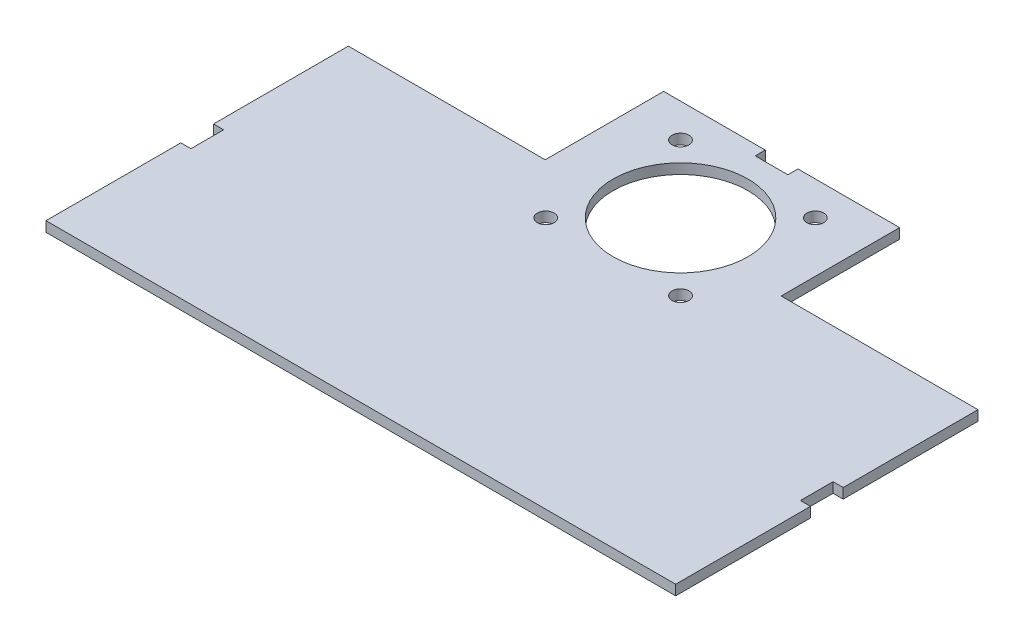
from build123d import *

# Parameters (mm, degrees)
BOSS_EXTRUDE1_DEPTH = 3
SKETCH3_R           = 2.5
SKETCH3_R_2         = 20
CUT_EXTRUDE1_DEPTH  = 10


with BuildPart() as part:
    # Sketch1 → Boss-Extrude1 (new body)
    with BuildSketch(Plane(origin=(0, 0, 0), x_dir=(1, 0, 0), z_dir=(0, 1, 0))):
        Polygon((-148.288384344, -111.309139144), (-148.288384344, -101.609139144), (-151.288384344, -101.609139144), (-151.288384344, -61.609139144), (-92.878384344, -61.609139144), (-92.878384344, -26.459139144), (-62.728384344, -26.459139144), (-62.728384344, -29.459139144), (-53.028384344, -29.459139144), (-53.028384344, -26.459139144), (-22.878384344, -26.459139144), (-22.878384344, -61.609139144), (35.531615656, -61.609139144), (35.531615656, -101.609139144), (32.531615656, -101.609139144), (32.531615656, -111.309139144), (35.531615656, -111.309139144), (35.531615656, -151.309139144), (-151.288384344, -151.309139144), (-151.288384344, -111.309139144), align=None)
    extrude(amount=BOSS_EXTRUDE1_DEPTH)

    # Sketch3 → Cut-Extrude1 (cut)
    with BuildSketch(Plane(origin=(0, 3, 0), x_dir=(1, 0, 0), z_dir=(0, 1, 0))):
        with Locations(Location((-77.878384344, -36.459139144, 0), (0, 0, 270))):
            Circle(SKETCH3_R)
        with Locations(Location((-37.878384344, -36.459139144, 0), (0, 0, 270))):
            Circle(SKETCH3_R)
        with Locations(Location((-37.878384344, -76.459139144, 0), (0, 0, 90))):
            Circle(SKETCH3_R)
        with Locations(Location((-77.878384344, -76.459139144, 0), (0, 0, 90))):
            Circle(SKETCH3_R)
        with Locations(Location((-57.878384344, -56.459139144, 0), (0, 0, 270))):
            Circle(SKETCH3_R_2)
    extrude(amount=-CUT_EXTRUDE1_DEPTH, mode=Mode.SUBTRACT)


solid = part.part
